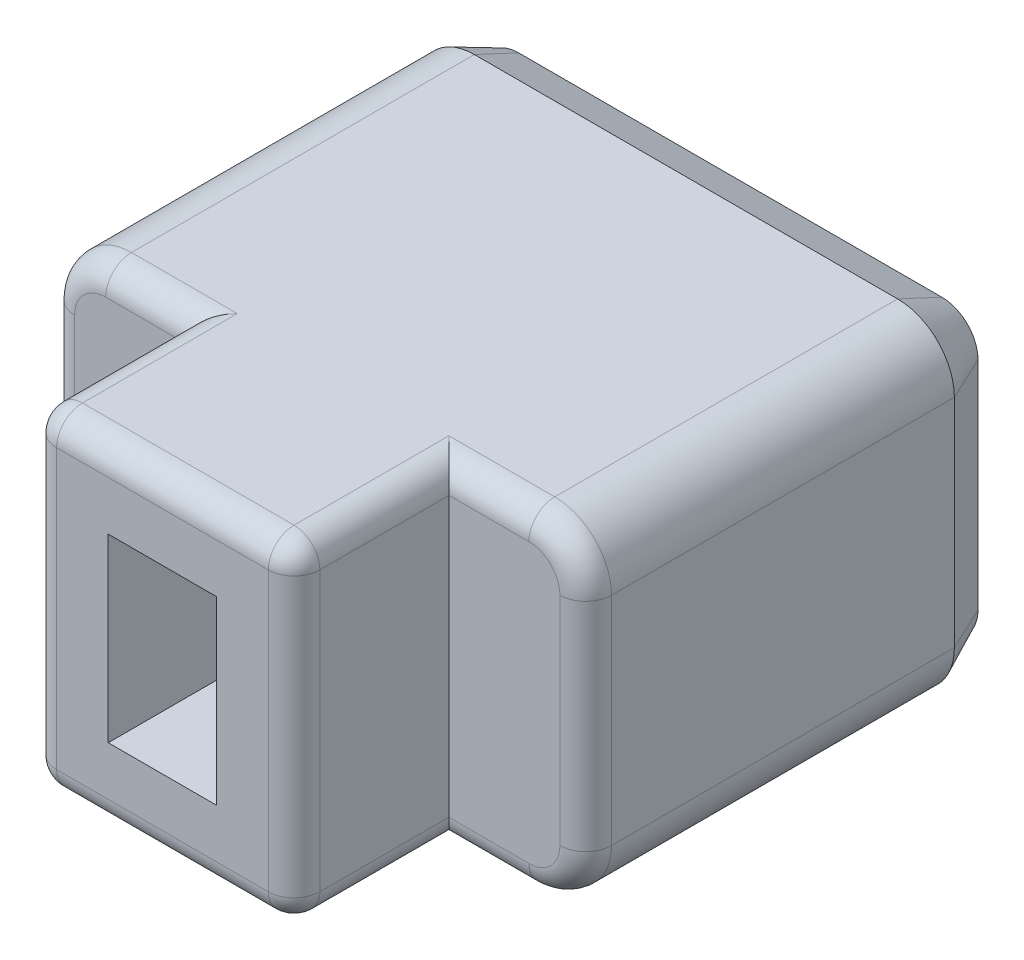
from build123d import *

# Parameters (mm, degrees)
BOSS_EXTRU_1_DEPTH      = 11
ESQUISSE3_W             = 2.1
ESQUISSE3_H             = 3.5
ENL_V_MAT_EXTRU_1_DEPTH = 3
ESQUISSE4_OUTSIDE_W     = 15.688
ESQUISSE4_OUTSIDE_H     = 11.688
ESQUISSE4_OUTSIDE_W_2   = 5.1
ESQUISSE4_OUTSIDE_H_2   = 6.4
ENL_V_MAT_EXTRU_2_DEPTH = 3
CONG_1_R                = 0.5
CHANFREIN1_SIZE         = 0.4
CHANFREIN1_SIZE2        = 0.857802768
ENL_V_MAT_EXTRU_3_DEPTH = 0.3
BOSS_EXTRU_2_DEPTH      = 0.3
BOSS_EXTRU_2_2_DEPTH    = 0.3
BOSS_EXTRU_2_3_DEPTH    = 0.3


with BuildPart() as part:
    # Esquisse2 → Boss.-Extru.1 (new body)
    with BuildSketch(Plane.XY):
        with BuildLine():
            Line((1.1, 0), (9.3, 0))
            ThreePointArc((9.3, 0), (10.077817459, 0.322182541), (10.4, 1.1))
            Line((10.4, 1.1), (10.4, 5.3))
            ThreePointArc((10.4, 5.3), (10.077817459, 6.077817459), (9.3, 6.4))
            Line((9.3, 6.4), (1.1, 6.4))
            ThreePointArc((1.1, 6.4), (0.322182541, 6.077817459), (0, 5.3))
            Line((0, 5.3), (0, 1.1))
            ThreePointArc((0, 1.1), (0.322182541, 0.322182541), (1.1, 0))
        make_face()
    extrude(amount=BOSS_EXTRU_1_DEPTH)

    # Esquisse3 → Enlèv. mat.-Extru.1 (cut)
    with BuildSketch(Plane.XY.offset(11)):
        with Locations((5.2, 3.2)):
            Rectangle(ESQUISSE3_W, ESQUISSE3_H)
    extrude(amount=-ENL_V_MAT_EXTRU_1_DEPTH, mode=Mode.SUBTRACT)

    # Esquisse4 outside → Enlèv. mat.-Extru.2 (cut)
    with BuildSketch(Plane.XY.offset(11)):
        with Locations((5.2, 3.2)):
            Rectangle(ESQUISSE4_OUTSIDE_W, ESQUISSE4_OUTSIDE_H)
        with Locations((5.2, 3.2)):
            Rectangle(ESQUISSE4_OUTSIDE_W_2, ESQUISSE4_OUTSIDE_H_2, mode=Mode.SUBTRACT)
    extrude(amount=-ENL_V_MAT_EXTRU_2_DEPTH, mode=Mode.SUBTRACT)

    # Congé1
    cong_1_edges = [part.edges().sort_by_distance(p)[0] for p in [
        (8.525, 0, 8),
        (10.077817459, 0.322182541, 8),
        (10.4, 3.2, 8),
        (10.077817459, 6.077817459, 8),
        (1.875, 6.4, 8),
        (0.322182541, 6.077817459, 8),
        (1.875, 0, 8),
        (0.322182541, 0.322182541, 8),
        (7.75, 6.4, 9.5),
        (2.65, 6.4, 9.5),
        (7.75, 0, 9.5),
        (2.65, 0, 9.5),
        (2.65, 3.2, 11),
        (5.2, 6.4, 11),
        (7.75, 3.2, 11),
        (5.2, 0, 11),
        (8.525, 6.4, 8),
        (0, 3.2, 8),
    ]]
    fillet(cong_1_edges, radius=CONG_1_R)

    # Chanfrein1
    chanfrein1_edges = [part.edges().sort_by_distance(p)[0] for p in [
        (5.2, 0, 0),
        (10.077817459, 0.322182541, 0),
        (0.322182541, 0.322182541, 0),
        (10.4, 3.2, 0),
        (0, 3.2, 0),
        (10.077817459, 6.077817459, 0),
        (0.322182541, 6.077817459, 0),
        (5.2, 6.4, 0),
    ]]
    chanfrein1_side = [part.faces().sort_by_distance(p)[0] for p in [
        (5.2, 3.2, 0),
    ]]
    chamfer(chanfrein1_edges, length=CHANFREIN1_SIZE, length2=CHANFREIN1_SIZE2, reference=chanfrein1_side[0])

    # Esquisse5 → Enlèv. mat.-Extru.3 (cut)
    # profile 1 of 3: a face of its own
    with BuildSketch(Plane(origin=(0, 0, 0), x_dir=(-1, 0, 0), z_dir=(0, 0, -1))):
        with BuildLine():
            Line((-4.276923077, 2.033974359), (-4.000480769, 2.274358974))
            add(Edge.make_bspline(
                [(-4.000480769, 2.274358974), (-3.962102197, 2.222140609), (-3.886775783, 2.119650549), (-3.755756238, 1.984141613), (-3.613251162, 1.868933007), (-3.460095419, 1.773322739), (-3.29682901, 1.69968982), (-3.125457967, 1.646548969), (-2.946218196, 1.613219489), (-2.823810126, 1.609552821), (-2.761698718, 1.607692308)],
                knots=[0, 0, 0, 0, 1.059844169, 2.080177969, 3.074997252, 4.05282142, 5.027209033, 5.99793136, 6.984124963, 8, 8, 8, 8], degree=3))
            add(Edge.make_bspline(
                [(-2.761698718, 1.607692308), (-2.727474352, 1.608152442), (-2.659369594, 1.609068087), (-2.558253532, 1.62123278), (-2.45882019, 1.638378111), (-2.361532921, 1.663255399), (-2.266556515, 1.696027084), (-2.172534217, 1.733781483), (-2.081443986, 1.780884494), (-1.992377993, 1.833527867), (-1.907144766, 1.892677342), (-1.82605109, 1.956898185), (-1.749694689, 2.02564327), (-1.679105422, 2.100108345), (-1.612383779, 2.178273853), (-1.551325074, 2.261850409), (-1.496181054, 2.350656354), (-1.444797072, 2.443188098), (-1.399109124, 2.540018487), (-1.360034227, 2.640574138), (-1.326030175, 2.743961711), (-1.299222293, 2.850648963), (-1.277282703, 2.959686125), (-1.262071354, 3.071811804), (-1.253313907, 3.18687754), (-1.251963406, 3.264728865), (-1.251282051, 3.30400641)],
                knots=[0, 0, 0, 0, 0.97289461, 1.936011137, 2.892754515, 3.841684151, 4.788238795, 5.748985364, 6.720692793, 7.701769213, 8.6901134, 9.668951799, 10.6424691, 11.609651951, 12.585301174, 13.563874206, 14.550347966, 15.556832669, 16.572962131, 17.592946595, 18.623597964, 19.666496227, 20.719856773, 21.785663574, 22.88282314, 24, 24, 24, 24], degree=3))
            add(Edge.make_bspline(
                [(-1.251282051, 3.30400641), (-1.252296991, 3.363107044), (-1.254287635, 3.479023632), (-1.276329854, 3.64883825), (-1.309111755, 3.811628739), (-1.357692697, 3.966485248), (-1.418706228, 4.11418425), (-1.493512611, 4.254523099), (-1.582914401, 4.386715435), (-1.68417268, 4.510513554), (-1.795775953, 4.622968802), (-1.915058284, 4.722122176), (-2.042287881, 4.805539023), (-2.176366905, 4.873751047), (-2.317892379, 4.927390857), (-2.466681504, 4.964264703), (-2.622262689, 4.988840334), (-2.728482199, 4.991138347), (-2.782532051, 4.992307692)],
                knots=[0, 0, 0, 0, 1.112954785, 2.182885596, 3.221232596, 4.238398056, 5.235647242, 6.228569394, 7.229380626, 8.237855998, 9.237844397, 10.210210665, 11.155206134, 12.098269864, 13.039545894, 14.000171849, 14.982386428, 16, 16, 16, 16], degree=3))
            add(Edge.make_bspline(
                [(-2.782532051, 4.992307692), (-2.841968738, 4.990370489), (-2.959281408, 4.98654695), (-3.131353159, 4.954167609), (-3.296160274, 4.90194349), (-3.45347852, 4.828445211), (-3.602855159, 4.733536845), (-3.744357048, 4.617761095), (-3.879249498, 4.481775907), (-3.959339012, 4.378627877), (-4.000480769, 4.325641026)],
                knots=[0, 0, 0, 0, 0.98701547, 1.94811365, 2.898400414, 3.853494756, 4.825030655, 5.831532994, 6.886064627, 8, 8, 8, 8], degree=3))
            Line((-4.000480769, 4.325641026), (-4.276923077, 4.563621795))
            add(Edge.make_bspline(
                [(-4.276923077, 4.563621795), (-4.255144937, 4.596218141), (-4.211783743, 4.661118837), (-4.140480519, 4.752603201), (-4.065765531, 4.83891057), (-3.987049712, 4.919139706), (-3.904369455, 4.994138271), (-3.816977162, 5.062661573), (-3.726194432, 5.126321568), (-3.631651093, 5.184250318), (-3.533153339, 5.235097115), (-3.432039281, 5.280594637), (-3.327599133, 5.31771745), (-3.220882842, 5.34985195), (-3.110732473, 5.372107074), (-2.998305425, 5.390367274), (-2.882894474, 5.400883872), (-2.804988075, 5.402000874), (-2.765705128, 5.402564103)],
                knots=[0, 0, 0, 0, 1.041374987, 2.073421428, 3.079568686, 4.073273683, 5.058170465, 6.043552977, 7.022087575, 8.003141192, 8.987193764, 9.965779835, 10.946859123, 11.930527725, 12.924384778, 13.93018154, 14.956330036, 16, 16, 16, 16], degree=3))
            add(Edge.make_bspline(
                [(-2.765705128, 5.402564103), (-2.72828973, 5.402267935), (-2.654417621, 5.401683189), (-2.545370148, 5.392066353), (-2.439100683, 5.378934925), (-2.33597401, 5.35932637), (-2.235319604, 5.335948637), (-2.138310249, 5.304703061), (-2.04375213, 5.270139818), (-1.952704211, 5.228667823), (-1.864505778, 5.18240408), (-1.779285018, 5.129955518), (-1.696970644, 5.07231767), (-1.617267081, 5.009733107), (-1.541053686, 4.941422954), (-1.468057536, 4.867532053), (-1.398077871, 4.787962989), (-1.354355413, 4.731593845), (-1.332211538, 4.703044872)],
                knots=[0, 0, 0, 0, 1.082168949, 2.13660973, 3.165131306, 4.179150287, 5.172582136, 6.152699036, 7.125936765, 8.084022289, 9.045033083, 10.005950655, 10.977130504, 11.951134984, 12.93626608, 13.936288924, 14.954803513, 16, 16, 16, 16], degree=3))
            add(Edge.make_bspline(
                [(-1.332211538, 4.703044872), (-1.296738988, 4.653214139), (-1.22594324, 4.55376248), (-1.137944828, 4.392857912), (-1.060969548, 4.226187834), (-0.999171455, 4.050939516), (-0.951337208, 3.868102207), (-0.916775683, 3.677681935), (-0.896708809, 3.47965195), (-0.893791903, 3.345184151), (-0.892307692, 3.276762821)],
                knots=[0, 0, 0, 0, 0.965683317, 1.927300737, 2.89231067, 3.86402428, 4.85897487, 5.875476297, 6.918977332, 8, 8, 8, 8], degree=3))
            add(Edge.make_bspline(
                [(-0.892307692, 3.276762821), (-0.893641785, 3.204830865), (-0.89626433, 3.063427756), (-0.923028592, 2.856006965), (-0.964413002, 2.657347371), (-1.02183253, 2.467032718), (-1.097907298, 2.285878807), (-1.190062555, 2.113288295), (-1.299187382, 1.949475621), (-1.423330644, 1.796266238), (-1.559024846, 1.655602283), (-1.705491993, 1.532776269), (-1.861316237, 1.429935291), (-2.02443932, 1.344118513), (-2.196521784, 1.277857782), (-2.377268642, 1.231747218), (-2.566328305, 1.202894235), (-2.695355103, 1.199274587), (-2.760897436, 1.197435897)],
                knots=[0, 0, 0, 0, 1.106177392, 2.174512289, 3.211769933, 4.225704522, 5.227752973, 6.229708733, 7.231529653, 8.251318105, 9.259716566, 10.234142726, 11.185817729, 12.12689365, 13.064806101, 14.01565564, 14.992003525, 16, 16, 16, 16], degree=3))
            add(Edge.make_bspline(
                [(-2.760897436, 1.197435897), (-2.800716264, 1.197990675), (-2.879692456, 1.199091014), (-2.996673033, 1.209733521), (-3.11086361, 1.227538864), (-3.222200709, 1.251488667), (-3.330735386, 1.281814962), (-3.436006637, 1.319508286), (-3.537956256, 1.36487344), (-3.637260964, 1.415732065), (-3.732536634, 1.473741801), (-3.824045288, 1.536821699), (-3.910770806, 1.606203122), (-3.993481357, 1.680567503), (-4.071056102, 1.760895625), (-4.144576419, 1.846347526), (-4.21331182, 1.937571204), (-4.255622291, 2.001692919), (-4.276923077, 2.033974359)],
                knots=[0, 0, 0, 0, 1.055012498, 2.092499289, 3.109576428, 4.116082065, 5.108754671, 6.093853283, 7.076278279, 8.063967189, 9.048429885, 10.030140686, 11.007324681, 11.989571177, 12.975661001, 13.964490532, 14.975242994, 16, 16, 16, 16], degree=3))
        make_face()
    # profile 2 of 3: a face of its own
    with BuildSketch(Plane(origin=(0, 0, 0), x_dir=(-1, 0, 0), z_dir=(0, 0, -1))):
        Polygon((-4.994871795, 1.3), (-5.353846154, 1.3), (-5.353846154, 4.88974359), (-6.687179487, 4.88974359), (-6.687179487, 5.3), (-4.994871795, 5.3), align=None)
    # profile 3 of 3: a face of its own
    with BuildSketch(Plane(origin=(0, 0, 0), x_dir=(-1, 0, 0), z_dir=(0, 0, -1))):
        with BuildLine():
            Line((-7.251282051, 1.3), (-7.953205128, 1.3))
            add(Edge.make_bspline(
                [(-7.953205128, 1.3), (-8.000213275, 1.3001758), (-8.090229963, 1.300512444), (-8.219280641, 1.30243476), (-8.336500089, 1.307883219), (-8.442114803, 1.312567873), (-8.535809249, 1.321160882), (-8.617721249, 1.329228391), (-8.687831754, 1.340225169), (-8.73022515, 1.350001033), (-8.749679487, 1.354487179)],
                knots=[0, 0, 0, 0, 1.410548186, 2.701082353, 3.872164956, 4.931545487, 5.872643019, 6.694846481, 7.4010648, 8, 8, 8, 8], degree=3))
            add(Edge.make_bspline(
                [(-8.749679487, 1.354487179), (-8.775219142, 1.361740702), (-8.826017329, 1.376167905), (-8.898946116, 1.406439045), (-8.968754039, 1.441506074), (-9.035023293, 1.482432658), (-9.096721357, 1.530293066), (-9.155474521, 1.583010705), (-9.209907746, 1.642142742), (-9.261575252, 1.705691029), (-9.30650735, 1.775470425), (-9.347189404, 1.84848438), (-9.380825789, 1.926168245), (-9.408644542, 2.007354342), (-9.430644393, 2.092501008), (-9.445627938, 2.181499618), (-9.454418557, 2.274448402), (-9.455739755, 2.337641421), (-9.456410256, 2.369711538)],
                knots=[0, 0, 0, 0, 0.953163587, 1.89583545, 2.831398256, 3.758060157, 4.68893587, 5.633315694, 6.590672633, 7.573797765, 8.571889309, 9.568272541, 10.573809546, 11.608637311, 12.649011887, 13.729676081, 14.847822807, 16, 16, 16, 16], degree=3))
            add(Edge.make_bspline(
                [(-9.456410256, 2.369711538), (-9.454663057, 2.422954138), (-9.451262795, 2.526570717), (-9.426392336, 2.677261673), (-9.38336416, 2.81754481), (-9.325595668, 2.948255807), (-9.249802259, 3.065244445), (-9.160162217, 3.169018947), (-9.054573529, 3.255709115), (-8.95606583, 3.316142217), (-8.868912965, 3.354829067), (-8.797494165, 3.381850513), (-8.719199942, 3.402787801), (-8.635563808, 3.421281099), (-8.545937966, 3.43568177), (-8.450458638, 3.445914246), (-8.348859215, 3.452378952), (-8.279069705, 3.453348696), (-8.243269231, 3.453846154)],
                knots=[0, 0, 0, 0, 1.376217794, 2.678287309, 3.93428021, 5.161237768, 6.360266741, 7.524963188, 8.691990789, 9.878588042, 10.499780802, 11.155222415, 11.850483239, 12.59271203, 13.369193386, 14.195792071, 15.07448124, 16, 16, 16, 16], degree=3))
            Line((-8.243269231, 3.453846154), (-9.507692308, 5.3))
            Line((-9.507692308, 5.3), (-9.052564103, 5.3))
            Line((-9.052564103, 5.3), (-7.788141026, 3.453846154))
            Line((-7.788141026, 3.453846154), (-7.61025641, 3.453846154))
            Line((-7.61025641, 3.453846154), (-7.61025641, 5.3))
            Line((-7.61025641, 5.3), (-7.251282051, 5.3))
            Line((-7.251282051, 5.3), (-7.251282051, 1.3))
        make_face()
        with BuildLine():
            Line((-7.61025641, 1.71025641), (-7.61025641, 3.043589744))
            Line((-7.61025641, 3.043589744), (-8.216826923, 3.049198718))
            add(Edge.make_bspline(
                [(-8.216826923, 3.049198718), (-8.245146327, 3.049210151), (-8.300214333, 3.049232382), (-8.379809255, 3.044690832), (-8.453879995, 3.039498774), (-8.522068625, 3.031522413), (-8.584666782, 3.021209602), (-8.641475664, 3.008671123), (-8.692610881, 2.993317462), (-8.752501703, 2.970298044), (-8.820426436, 2.934767812), (-8.891408601, 2.879433289), (-8.953648222, 2.813395636), (-9.004622403, 2.736538502), (-9.047111924, 2.652636038), (-9.074842312, 2.561970672), (-9.094965855, 2.46728064), (-9.096601446, 2.402142615), (-9.097435897, 2.368910256)],
                knots=[0, 0, 0, 0, 1.065115818, 2.071152542, 2.998223466, 3.858177936, 4.652718105, 5.384003046, 6.045176779, 6.659081028, 7.796261142, 8.913693857, 10.029725289, 11.194622041, 12.371932755, 13.553993211, 14.752087226, 16, 16, 16, 16], degree=3))
            add(Edge.make_bspline(
                [(-9.097435897, 2.368910256), (-9.096533537, 2.336760519), (-9.094750785, 2.273243778), (-9.075287125, 2.180651775), (-9.045613537, 2.092194398), (-9.004444137, 2.009394504), (-8.952463507, 1.935229452), (-8.892794911, 1.870951797), (-8.825292308, 1.818145247), (-8.762410283, 1.782945664), (-8.705599613, 1.762101483), (-8.657039222, 1.747469387), (-8.601660647, 1.736739671), (-8.540177939, 1.727226354), (-8.472048164, 1.71912867), (-8.397457945, 1.713725393), (-8.316482527, 1.710490094), (-8.260366501, 1.710336239), (-8.23125, 1.71025641)],
                knots=[0, 0, 0, 0, 1.233968552, 2.43789431, 3.619555944, 4.813196433, 5.977971186, 7.089174201, 8.171406254, 9.260239712, 9.841766941, 10.494663619, 11.20736683, 12.007361027, 12.8859566, 13.843359851, 14.8810003, 16, 16, 16, 16], degree=3))
            Line((-8.23125, 1.71025641), (-7.61025641, 1.71025641))
        make_face(mode=Mode.SUBTRACT)
    extrude(amount=-ENL_V_MAT_EXTRU_3_DEPTH, mode=Mode.SUBTRACT)


with BuildPart() as body_2:
    # Esquisse5<2> → Boss.-Extru.2 (new body)
    with BuildSketch(Plane(origin=(0, 0, 0), x_dir=(-1, 0, 0), z_dir=(0, 0, -1))):
        with BuildLine():
            Line((-4.276923077, 2.033974359), (-4.000480769, 2.274358974))
            add(Edge.make_bspline(
                [(-4.000480769, 2.274358974), (-3.962102197, 2.222140609), (-3.886775783, 2.119650549), (-3.755756238, 1.984141613), (-3.613251162, 1.868933007), (-3.460095419, 1.773322739), (-3.29682901, 1.69968982), (-3.125457967, 1.646548969), (-2.946218196, 1.613219489), (-2.823810126, 1.609552821), (-2.761698718, 1.607692308)],
                knots=[0, 0, 0, 0, 1.059844169, 2.080177969, 3.074997252, 4.05282142, 5.027209033, 5.99793136, 6.984124963, 8, 8, 8, 8], degree=3))
            add(Edge.make_bspline(
                [(-2.761698718, 1.607692308), (-2.727474352, 1.608152442), (-2.659369594, 1.609068087), (-2.558253532, 1.62123278), (-2.45882019, 1.638378111), (-2.361532921, 1.663255399), (-2.266556515, 1.696027084), (-2.172534217, 1.733781483), (-2.081443986, 1.780884494), (-1.992377993, 1.833527867), (-1.907144766, 1.892677342), (-1.82605109, 1.956898185), (-1.749694689, 2.02564327), (-1.679105422, 2.100108345), (-1.612383779, 2.178273853), (-1.551325074, 2.261850409), (-1.496181054, 2.350656354), (-1.444797072, 2.443188098), (-1.399109124, 2.540018487), (-1.360034227, 2.640574138), (-1.326030175, 2.743961711), (-1.299222293, 2.850648963), (-1.277282703, 2.959686125), (-1.262071354, 3.071811804), (-1.253313907, 3.18687754), (-1.251963406, 3.264728865), (-1.251282051, 3.30400641)],
                knots=[0, 0, 0, 0, 0.97289461, 1.936011137, 2.892754515, 3.841684151, 4.788238795, 5.748985364, 6.720692793, 7.701769213, 8.6901134, 9.668951799, 10.6424691, 11.609651951, 12.585301174, 13.563874206, 14.550347966, 15.556832669, 16.572962131, 17.592946595, 18.623597964, 19.666496227, 20.719856773, 21.785663574, 22.88282314, 24, 24, 24, 24], degree=3))
            add(Edge.make_bspline(
                [(-1.251282051, 3.30400641), (-1.252296991, 3.363107044), (-1.254287635, 3.479023632), (-1.276329854, 3.64883825), (-1.309111755, 3.811628739), (-1.357692697, 3.966485248), (-1.418706228, 4.11418425), (-1.493512611, 4.254523099), (-1.582914401, 4.386715435), (-1.68417268, 4.510513554), (-1.795775953, 4.622968802), (-1.915058284, 4.722122176), (-2.042287881, 4.805539023), (-2.176366905, 4.873751047), (-2.317892379, 4.927390857), (-2.466681504, 4.964264703), (-2.622262689, 4.988840334), (-2.728482199, 4.991138347), (-2.782532051, 4.992307692)],
                knots=[0, 0, 0, 0, 1.112954785, 2.182885596, 3.221232596, 4.238398056, 5.235647242, 6.228569394, 7.229380626, 8.237855998, 9.237844397, 10.210210665, 11.155206134, 12.098269864, 13.039545894, 14.000171849, 14.982386428, 16, 16, 16, 16], degree=3))
            add(Edge.make_bspline(
                [(-2.782532051, 4.992307692), (-2.841968738, 4.990370489), (-2.959281408, 4.98654695), (-3.131353159, 4.954167609), (-3.296160274, 4.90194349), (-3.45347852, 4.828445211), (-3.602855159, 4.733536845), (-3.744357048, 4.617761095), (-3.879249498, 4.481775907), (-3.959339012, 4.378627877), (-4.000480769, 4.325641026)],
                knots=[0, 0, 0, 0, 0.98701547, 1.94811365, 2.898400414, 3.853494756, 4.825030655, 5.831532994, 6.886064627, 8, 8, 8, 8], degree=3))
            Line((-4.000480769, 4.325641026), (-4.276923077, 4.563621795))
            add(Edge.make_bspline(
                [(-4.276923077, 4.563621795), (-4.255144937, 4.596218141), (-4.211783743, 4.661118837), (-4.140480519, 4.752603201), (-4.065765531, 4.83891057), (-3.987049712, 4.919139706), (-3.904369455, 4.994138271), (-3.816977162, 5.062661573), (-3.726194432, 5.126321568), (-3.631651093, 5.184250318), (-3.533153339, 5.235097115), (-3.432039281, 5.280594637), (-3.327599133, 5.31771745), (-3.220882842, 5.34985195), (-3.110732473, 5.372107074), (-2.998305425, 5.390367274), (-2.882894474, 5.400883872), (-2.804988075, 5.402000874), (-2.765705128, 5.402564103)],
                knots=[0, 0, 0, 0, 1.041374987, 2.073421428, 3.079568686, 4.073273683, 5.058170465, 6.043552977, 7.022087575, 8.003141192, 8.987193764, 9.965779835, 10.946859123, 11.930527725, 12.924384778, 13.93018154, 14.956330036, 16, 16, 16, 16], degree=3))
            add(Edge.make_bspline(
                [(-2.765705128, 5.402564103), (-2.72828973, 5.402267935), (-2.654417621, 5.401683189), (-2.545370148, 5.392066353), (-2.439100683, 5.378934925), (-2.33597401, 5.35932637), (-2.235319604, 5.335948637), (-2.138310249, 5.304703061), (-2.04375213, 5.270139818), (-1.952704211, 5.228667823), (-1.864505778, 5.18240408), (-1.779285018, 5.129955518), (-1.696970644, 5.07231767), (-1.617267081, 5.009733107), (-1.541053686, 4.941422954), (-1.468057536, 4.867532053), (-1.398077871, 4.787962989), (-1.354355413, 4.731593845), (-1.332211538, 4.703044872)],
                knots=[0, 0, 0, 0, 1.082168949, 2.13660973, 3.165131306, 4.179150287, 5.172582136, 6.152699036, 7.125936765, 8.084022289, 9.045033083, 10.005950655, 10.977130504, 11.951134984, 12.93626608, 13.936288924, 14.954803513, 16, 16, 16, 16], degree=3))
            add(Edge.make_bspline(
                [(-1.332211538, 4.703044872), (-1.296738988, 4.653214139), (-1.22594324, 4.55376248), (-1.137944828, 4.392857912), (-1.060969548, 4.226187834), (-0.999171455, 4.050939516), (-0.951337208, 3.868102207), (-0.916775683, 3.677681935), (-0.896708809, 3.47965195), (-0.893791903, 3.345184151), (-0.892307692, 3.276762821)],
                knots=[0, 0, 0, 0, 0.965683317, 1.927300737, 2.89231067, 3.86402428, 4.85897487, 5.875476297, 6.918977332, 8, 8, 8, 8], degree=3))
            add(Edge.make_bspline(
                [(-0.892307692, 3.276762821), (-0.893641785, 3.204830865), (-0.89626433, 3.063427756), (-0.923028592, 2.856006965), (-0.964413002, 2.657347371), (-1.02183253, 2.467032718), (-1.097907298, 2.285878807), (-1.190062555, 2.113288295), (-1.299187382, 1.949475621), (-1.423330644, 1.796266238), (-1.559024846, 1.655602283), (-1.705491993, 1.532776269), (-1.861316237, 1.429935291), (-2.02443932, 1.344118513), (-2.196521784, 1.277857782), (-2.377268642, 1.231747218), (-2.566328305, 1.202894235), (-2.695355103, 1.199274587), (-2.760897436, 1.197435897)],
                knots=[0, 0, 0, 0, 1.106177392, 2.174512289, 3.211769933, 4.225704522, 5.227752973, 6.229708733, 7.231529653, 8.251318105, 9.259716566, 10.234142726, 11.185817729, 12.12689365, 13.064806101, 14.01565564, 14.992003525, 16, 16, 16, 16], degree=3))
            add(Edge.make_bspline(
                [(-2.760897436, 1.197435897), (-2.800716264, 1.197990675), (-2.879692456, 1.199091014), (-2.996673033, 1.209733521), (-3.11086361, 1.227538864), (-3.222200709, 1.251488667), (-3.330735386, 1.281814962), (-3.436006637, 1.319508286), (-3.537956256, 1.36487344), (-3.637260964, 1.415732065), (-3.732536634, 1.473741801), (-3.824045288, 1.536821699), (-3.910770806, 1.606203122), (-3.993481357, 1.680567503), (-4.071056102, 1.760895625), (-4.144576419, 1.846347526), (-4.21331182, 1.937571204), (-4.255622291, 2.001692919), (-4.276923077, 2.033974359)],
                knots=[0, 0, 0, 0, 1.055012498, 2.092499289, 3.109576428, 4.116082065, 5.108754671, 6.093853283, 7.076278279, 8.063967189, 9.048429885, 10.030140686, 11.007324681, 11.989571177, 12.975661001, 13.964490532, 14.975242994, 16, 16, 16, 16], degree=3))
        make_face()
    extrude(amount=BOSS_EXTRU_2_DEPTH)


with BuildPart() as body_3:
    # Esquisse5<2> → Boss.-Extru.2 2 (new body)
    with BuildSketch(Plane(origin=(0, 0, 0), x_dir=(-1, 0, 0), z_dir=(0, 0, -1))):
        Polygon((-4.994871795, 1.3), (-5.353846154, 1.3), (-5.353846154, 4.88974359), (-6.687179487, 4.88974359), (-6.687179487, 5.3), (-4.994871795, 5.3), align=None)
    extrude(amount=BOSS_EXTRU_2_2_DEPTH)


with BuildPart() as body_4:
    # Esquisse5<2> → Boss.-Extru.2 3 (new body)
    with BuildSketch(Plane(origin=(0, 0, 0), x_dir=(-1, 0, 0), z_dir=(0, 0, -1))):
        with BuildLine():
            Line((-7.251282051, 1.3), (-7.953205128, 1.3))
            add(Edge.make_bspline(
                [(-7.953205128, 1.3), (-8.000213275, 1.3001758), (-8.090229963, 1.300512444), (-8.219280641, 1.30243476), (-8.336500089, 1.307883219), (-8.442114803, 1.312567873), (-8.535809249, 1.321160882), (-8.617721249, 1.329228391), (-8.687831754, 1.340225169), (-8.73022515, 1.350001033), (-8.749679487, 1.354487179)],
                knots=[0, 0, 0, 0, 1.410548186, 2.701082353, 3.872164956, 4.931545487, 5.872643019, 6.694846481, 7.4010648, 8, 8, 8, 8], degree=3))
            add(Edge.make_bspline(
                [(-8.749679487, 1.354487179), (-8.775219142, 1.361740702), (-8.826017329, 1.376167905), (-8.898946116, 1.406439045), (-8.968754039, 1.441506074), (-9.035023293, 1.482432658), (-9.096721357, 1.530293066), (-9.155474521, 1.583010705), (-9.209907746, 1.642142742), (-9.261575252, 1.705691029), (-9.30650735, 1.775470425), (-9.347189404, 1.84848438), (-9.380825789, 1.926168245), (-9.408644542, 2.007354342), (-9.430644393, 2.092501008), (-9.445627938, 2.181499618), (-9.454418557, 2.274448402), (-9.455739755, 2.337641421), (-9.456410256, 2.369711538)],
                knots=[0, 0, 0, 0, 0.953163587, 1.89583545, 2.831398256, 3.758060157, 4.68893587, 5.633315694, 6.590672633, 7.573797765, 8.571889309, 9.568272541, 10.573809546, 11.608637311, 12.649011887, 13.729676081, 14.847822807, 16, 16, 16, 16], degree=3))
            add(Edge.make_bspline(
                [(-9.456410256, 2.369711538), (-9.454663057, 2.422954138), (-9.451262795, 2.526570717), (-9.426392336, 2.677261673), (-9.38336416, 2.81754481), (-9.325595668, 2.948255807), (-9.249802259, 3.065244445), (-9.160162217, 3.169018947), (-9.054573529, 3.255709115), (-8.95606583, 3.316142217), (-8.868912965, 3.354829067), (-8.797494165, 3.381850513), (-8.719199942, 3.402787801), (-8.635563808, 3.421281099), (-8.545937966, 3.43568177), (-8.450458638, 3.445914246), (-8.348859215, 3.452378952), (-8.279069705, 3.453348696), (-8.243269231, 3.453846154)],
                knots=[0, 0, 0, 0, 1.376217794, 2.678287309, 3.93428021, 5.161237768, 6.360266741, 7.524963188, 8.691990789, 9.878588042, 10.499780802, 11.155222415, 11.850483239, 12.59271203, 13.369193386, 14.195792071, 15.07448124, 16, 16, 16, 16], degree=3))
            Line((-8.243269231, 3.453846154), (-9.507692308, 5.3))
            Line((-9.507692308, 5.3), (-9.052564103, 5.3))
            Line((-9.052564103, 5.3), (-7.788141026, 3.453846154))
            Line((-7.788141026, 3.453846154), (-7.61025641, 3.453846154))
            Line((-7.61025641, 3.453846154), (-7.61025641, 5.3))
            Line((-7.61025641, 5.3), (-7.251282051, 5.3))
            Line((-7.251282051, 5.3), (-7.251282051, 1.3))
        make_face()
        with BuildLine():
            Line((-7.61025641, 1.71025641), (-7.61025641, 3.043589744))
            Line((-7.61025641, 3.043589744), (-8.216826923, 3.049198718))
            add(Edge.make_bspline(
                [(-8.216826923, 3.049198718), (-8.245146327, 3.049210151), (-8.300214333, 3.049232382), (-8.379809255, 3.044690832), (-8.453879995, 3.039498774), (-8.522068625, 3.031522413), (-8.584666782, 3.021209602), (-8.641475664, 3.008671123), (-8.692610881, 2.993317462), (-8.752501703, 2.970298044), (-8.820426436, 2.934767812), (-8.891408601, 2.879433289), (-8.953648222, 2.813395636), (-9.004622403, 2.736538502), (-9.047111924, 2.652636038), (-9.074842312, 2.561970672), (-9.094965855, 2.46728064), (-9.096601446, 2.402142615), (-9.097435897, 2.368910256)],
                knots=[0, 0, 0, 0, 1.065115818, 2.071152542, 2.998223466, 3.858177936, 4.652718105, 5.384003046, 6.045176779, 6.659081028, 7.796261142, 8.913693857, 10.029725289, 11.194622041, 12.371932755, 13.553993211, 14.752087226, 16, 16, 16, 16], degree=3))
            add(Edge.make_bspline(
                [(-9.097435897, 2.368910256), (-9.096533537, 2.336760519), (-9.094750785, 2.273243778), (-9.075287125, 2.180651775), (-9.045613537, 2.092194398), (-9.004444137, 2.009394504), (-8.952463507, 1.935229452), (-8.892794911, 1.870951797), (-8.825292308, 1.818145247), (-8.762410283, 1.782945664), (-8.705599613, 1.762101483), (-8.657039222, 1.747469387), (-8.601660647, 1.736739671), (-8.540177939, 1.727226354), (-8.472048164, 1.71912867), (-8.397457945, 1.713725393), (-8.316482527, 1.710490094), (-8.260366501, 1.710336239), (-8.23125, 1.71025641)],
                knots=[0, 0, 0, 0, 1.233968552, 2.43789431, 3.619555944, 4.813196433, 5.977971186, 7.089174201, 8.171406254, 9.260239712, 9.841766941, 10.494663619, 11.20736683, 12.007361027, 12.8859566, 13.843359851, 14.8810003, 16, 16, 16, 16], degree=3))
            Line((-8.23125, 1.71025641), (-7.61025641, 1.71025641))
        make_face(mode=Mode.SUBTRACT)
    extrude(amount=BOSS_EXTRU_2_3_DEPTH)


solid = Compound([part.part, body_2.part, body_3.part, body_4.part])
